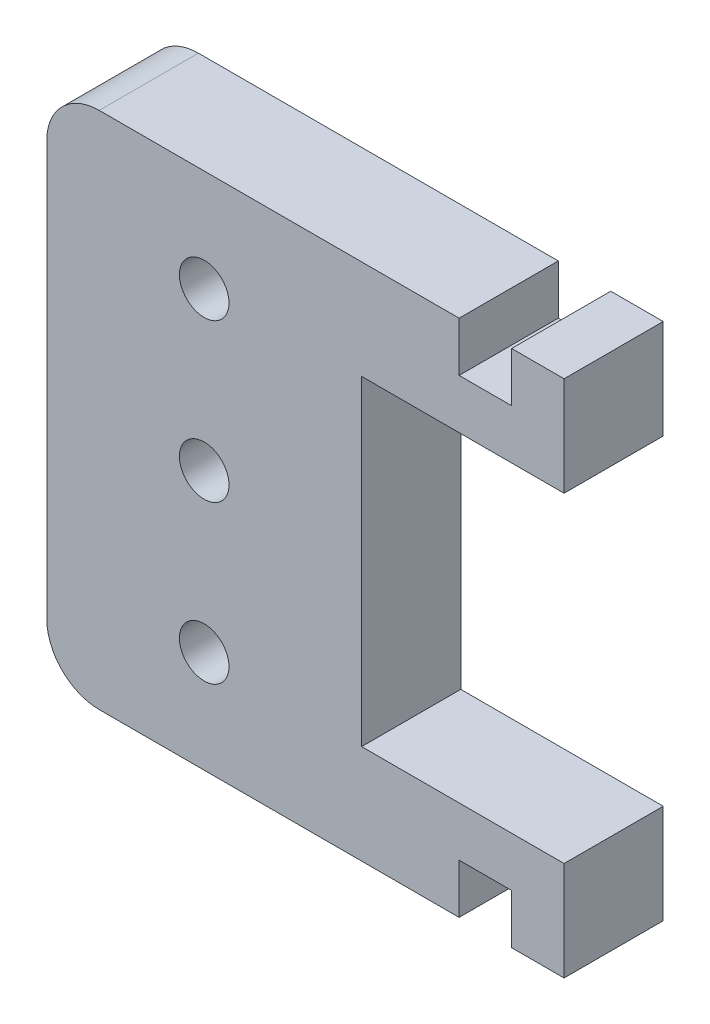
from build123d import *

# Parameters (mm, degrees)
SKETCH1_W               = 19.05
SKETCH1_H               = 31.399999938
BOSS_EXTRUDE1_DEPTH     = 3
FILLET1_R               = 3.175
CUT_EXTRUDE1_DEPTH      = 28.507101338
CUT_EXTRUDE1_DEPTH_BACK = 28.507101338
SKETCH2_R               = 1.5


with BuildPart() as part:
    # Sketch1 → Boss-Extrude1 (new, symmetric)
    with BuildSketch(Plane.XY):
        Rectangle(SKETCH1_W, SKETCH1_H)
        Polygon((9.525, 15.699999969), (9.525, 9.699999969), (21.775, 9.699999969), (21.775, 15.699999969), (18.6, 15.699999969), (18.6, 12.699999969), (15.425, 12.699999969), (15.425, 15.699999969), align=None)
        Polygon((9.525, -15.699999969), (15.425, -15.699999969), (15.425, -12.699999969), (18.6, -12.699999969), (18.6, -15.699999969), (21.775, -15.699999969), (21.775, -9.699999969), (9.525, -9.699999969), align=None)
    extrude(amount=BOSS_EXTRUDE1_DEPTH, both=True)

    # Fillet1
    fillet1_edges = [part.edges().sort_by_distance(p)[0] for p in [
        (-9.525, -15.699999969, 0),
        (-9.525, 15.699999969, 0),
    ]]
    fillet(fillet1_edges, radius=FILLET1_R)

    # Sketch2 → Cut-Extrude1 (cut, two sides: drawn at the far end of the back side and taken through both)
    with BuildSketch(Plane.XY.offset(3).offset(-CUT_EXTRUDE1_DEPTH_BACK)):
        with Locations((0, 9.525)):
            Circle(SKETCH2_R)
        with Locations((0, -9.525)):
            Circle(SKETCH2_R)
        Circle(SKETCH2_R)
    extrude(amount=CUT_EXTRUDE1_DEPTH + CUT_EXTRUDE1_DEPTH_BACK, mode=Mode.SUBTRACT)


solid = part.part
